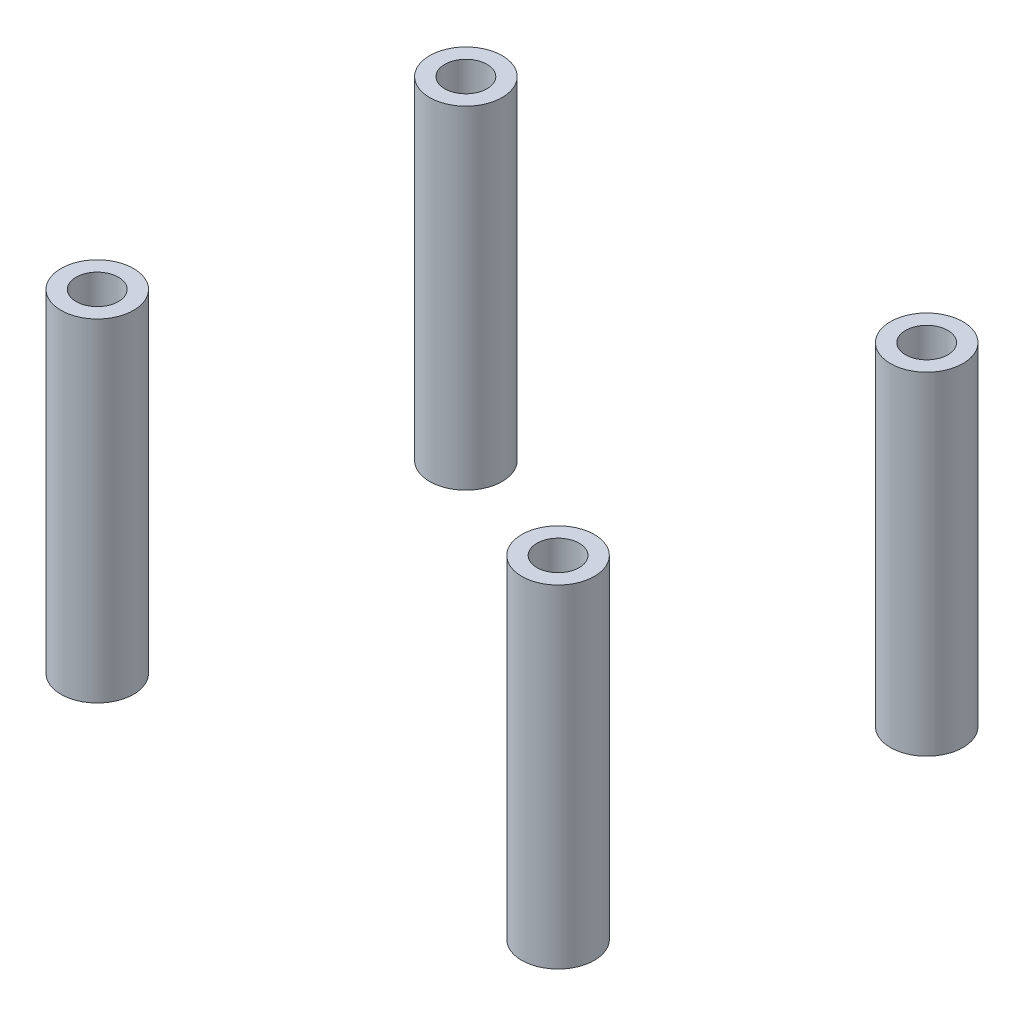
from build123d import *

# Parameters (mm, degrees)
SKETCH1_R             = 3
SKETCH1_R_2           = 1.75
BOSS_EXTRUDE1_DEPTH   = 27.5
BOSS_EXTRUDE1_2_DEPTH = 27.5
BOSS_EXTRUDE1_3_DEPTH = 27.5
BOSS_EXTRUDE1_4_DEPTH = 27.5


with BuildPart() as part:
    # Sketch1 → Boss-Extrude1 (new body)
    with BuildSketch(Plane(origin=(0, 0, 0), x_dir=(1, 0, 0), z_dir=(0, 1, 0))):
        with Locations(Location((-19.05, 15.24, 0), (0, 0, 270))):
            Circle(SKETCH1_R)
        with Locations(Location((-19.05, 15.24, 0), (0, 0, 270))):
            Circle(SKETCH1_R_2, mode=Mode.SUBTRACT)
    extrude(amount=BOSS_EXTRUDE1_DEPTH)


with BuildPart() as body_2:
    # Sketch1 → Boss-Extrude1 2 (new body)
    with BuildSketch(Plane(origin=(0, 0, 0), x_dir=(1, 0, 0), z_dir=(0, 1, 0))):
        with Locations(Location((19.05, 15.24, 0), (0, 0, 270))):
            Circle(SKETCH1_R)
        with Locations(Location((19.05, 15.24, 0), (0, 0, 270))):
            Circle(SKETCH1_R_2, mode=Mode.SUBTRACT)
    extrude(amount=BOSS_EXTRUDE1_2_DEPTH)


with BuildPart() as body_3:
    # Sketch1 → Boss-Extrude1 3 (new body)
    with BuildSketch(Plane(origin=(0, 0, 0), x_dir=(1, 0, 0), z_dir=(0, 1, 0))):
        with Locations(Location((19.05, -15.24, 0), (0, 0, 270))):
            Circle(SKETCH1_R)
        with Locations(Location((19.05, -15.24, 0), (0, 0, 270))):
            Circle(SKETCH1_R_2, mode=Mode.SUBTRACT)
    extrude(amount=BOSS_EXTRUDE1_3_DEPTH)


with BuildPart() as body_4:
    # Sketch1 → Boss-Extrude1 4 (new body)
    with BuildSketch(Plane(origin=(0, 0, 0), x_dir=(1, 0, 0), z_dir=(0, 1, 0))):
        with Locations(Location((-19.05, -15.24, 0), (0, 0, 270))):
            Circle(SKETCH1_R)
        with Locations(Location((-19.05, -15.24, 0), (0, 0, 270))):
            Circle(SKETCH1_R_2, mode=Mode.SUBTRACT)
    extrude(amount=BOSS_EXTRUDE1_4_DEPTH)


solid = Compound([part.part, body_2.part, body_3.part, body_4.part])
